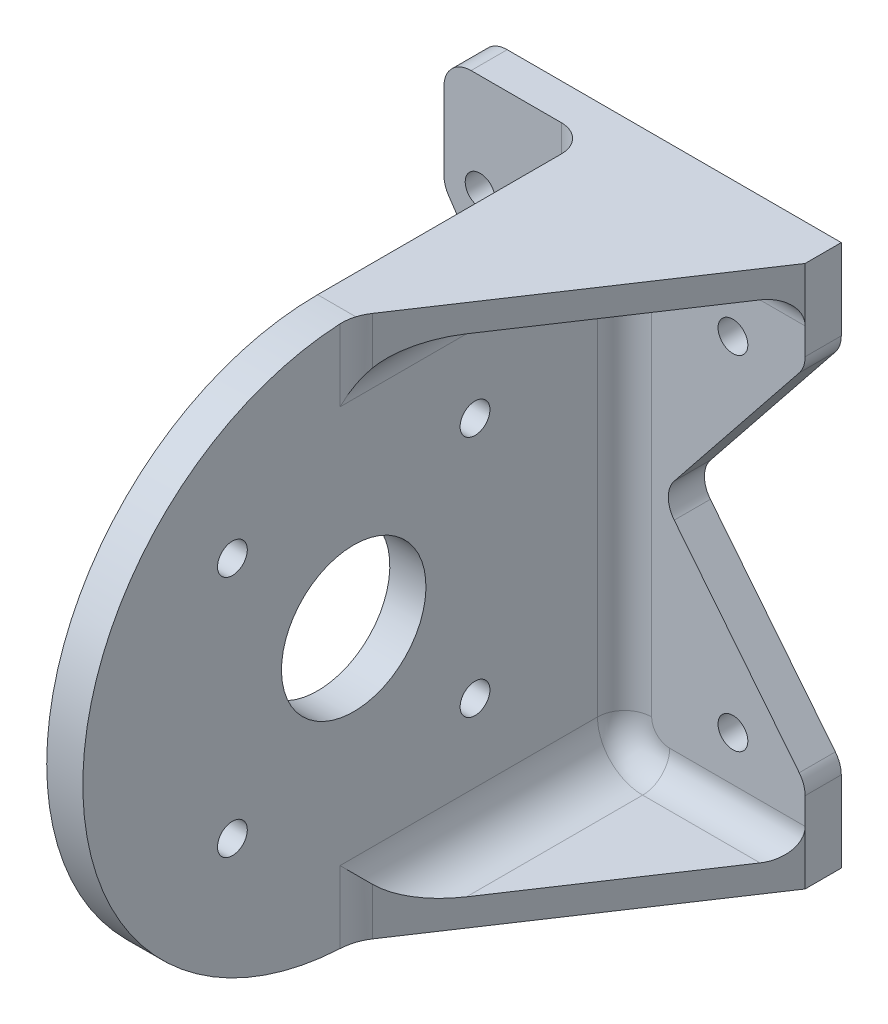
from build123d import *

# Parameters (mm, degrees)
SKETCH_3_W          = 20
SKETCH_3_H          = 60
EXTRUDE_2_DEPTH     = 4
SKETCH_4_R          = 8
SKETCH_4_R_2        = 1.65
EXTRUDE_3_DEPTH     = 4
SKETCH_9_W          = 20
SKETCH_9_H          = 60
EXTRUDE_6_DEPTH     = 4
EXTRUDE_4_DEPTH     = 3
EXTRUDE_7_DEPTH     = 3
SKETCH_7_R          = 1.65
CUT_EXTRUDE_1_DEPTH = 74.484692283
FILLET_1_R          = 5
FILLET_2_R          = 3
FILLET_3_R          = 3


with BuildPart() as part:
    # 草图3 → 凸台-拉伸2 (new body)
    with BuildSketch(Plane.XY):
        Rectangle(SKETCH_3_W, SKETCH_3_H)
    extrude(amount=EXTRUDE_2_DEPTH)

    # 草图4 → 凸台-拉伸3 (add)
    with BuildSketch(Plane(origin=(10, 0, 0), x_dir=(0, 0, -1), z_dir=(1, 0, 0))):
        with BuildLine():
            Line((0, 30), (-34, 30))
            ThreePointArc((-34, 30), (-64, 0), (-34, -30))
            Line((-34, -30), (0, -30))
            Line((0, -30), (0, 30))
        make_face()
        with Locations(Location((-34, 0, 0), (0, 0, 90))):
            Circle(SKETCH_4_R, mode=Mode.SUBTRACT)
        with Locations(Location((-47.435028843, 13.435028843, 0), (0, 0, 90))):
            Circle(SKETCH_4_R_2, mode=Mode.SUBTRACT)
        with Locations(Location((-20.564971157, 13.435028843, 0), (0, 0, 270))):
            Circle(SKETCH_4_R_2, mode=Mode.SUBTRACT)
        with Locations(Location((-20.564971157, -13.435028843, 0), (0, 0, 90))):
            Circle(SKETCH_4_R_2, mode=Mode.SUBTRACT)
        with Locations(Location((-47.435028843, -13.435028843, 0), (0, 0, 270))):
            Circle(SKETCH_4_R_2, mode=Mode.SUBTRACT)
    extrude(amount=-EXTRUDE_3_DEPTH)

    # 草图9 → 凸台-拉伸6 (add)
    with BuildSketch(Plane.XY):
        with Locations((20, 0)):
            Rectangle(SKETCH_9_W, SKETCH_9_H)
    extrude(amount=EXTRUDE_6_DEPTH)

    # 草图5 → 凸台-拉伸4 (add)
    with BuildSketch(Plane(origin=(0, 30, 0), x_dir=(1, 0, 0), z_dir=(0, 1, 0))):
        Polygon((10, -34), (30, -4), (10, -4), align=None)
    extrude(amount=-EXTRUDE_4_DEPTH)

    # 草图11 → 凸台-拉伸7 (add)
    with BuildSketch(Plane.XZ.offset(30)):
        Polygon((10, 34), (10, 4), (30, 4), align=None)
    extrude(amount=-EXTRUDE_7_DEPTH)

    # 草图7 → 切除-拉伸1 (cut, through all)
    with BuildSketch(Plane.XY.offset(4)):
        with Locations((-6, 19)):
            Circle(SKETCH_7_R)
        with Locations((22, 19)):
            Circle(SKETCH_7_R)
        with Locations((22, -19)):
            Circle(SKETCH_7_R)
        with Locations((-6, -19)):
            Circle(SKETCH_7_R)
        Polygon((-10, 17.5), (2, 0), (-10, -17.5), align=None)
        Polygon((14, 0), (30, 20), (30, -20), align=None)
    extrude(amount=-CUT_EXTRUDE_1_DEPTH, mode=Mode.SUBTRACT)

    # 圆角1
    fillet_1_edges = [part.edges().sort_by_distance(p)[0] for p in [
        (10, 27, 19),
        (10, 28.5, 34),
        (10, -28.5, 34),
        (10, -27, 19),
    ]]
    fillet(fillet_1_edges, radius=FILLET_1_R)

    # 圆角2
    fillet_2_edges = [part.edges().sort_by_distance(p)[0] for p in [
        (-10, -17.5, 2),
        (-10, 17.5, 2),
        (2, 0, 2),
        (30, -20, 2),
        (14, 0, 2),
        (30, 20, 2),
        (10, 0, 4),
        (22.5, -27, 4),
        (11.464466094, 25.535533906, 4),
        (11.464466094, -25.535533906, 4),
        (22.5, 27, 4),
    ]]
    fillet(fillet_2_edges, radius=FILLET_2_R)

    # 圆角3
    fillet_3_edges = [part.edges().sort_by_distance(p)[0] for p in [
        (6, 0, 4),
        (-10, 30, 2),
        (-10, -30, 2),
    ]]
    fillet(fillet_3_edges, radius=FILLET_3_R)


solid = part.part
